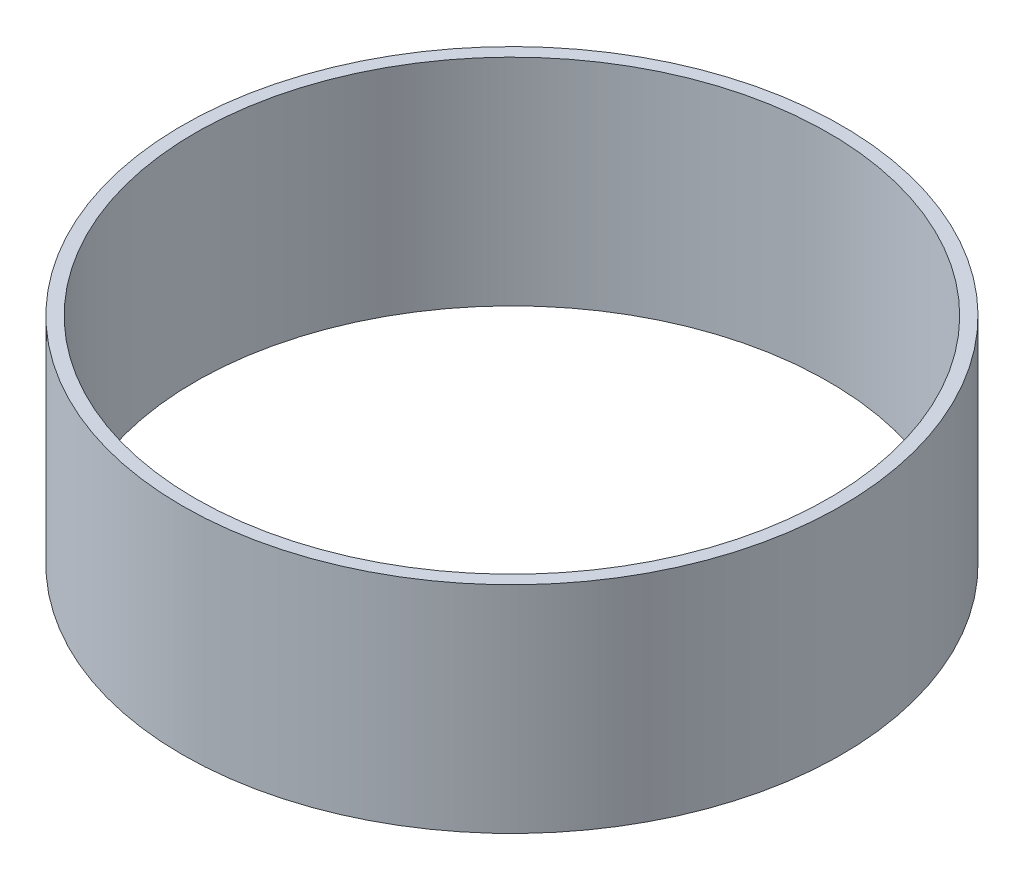
from build123d import *

# Parameters (mm, degrees)
SKETCH_1_R      = 7.65
SKETCH_1_R_2    = 7.35
EXTRUDE_1_DEPTH = 5


with BuildPart() as part:
    # Эскиз1 → Бобышка-Вытянуть1 (new body)
    with BuildSketch(Plane(origin=(0, 0, 0), x_dir=(1, 0, 0), z_dir=(0, 1, 0))):
        with Locations(Location((0, 0, 0), (0, 0, 270))):
            Circle(SKETCH_1_R)
        with Locations(Location((0, 0, 0), (0, 0, 270))):
            Circle(SKETCH_1_R_2, mode=Mode.SUBTRACT)
    extrude(amount=EXTRUDE_1_DEPTH)


solid = part.part
